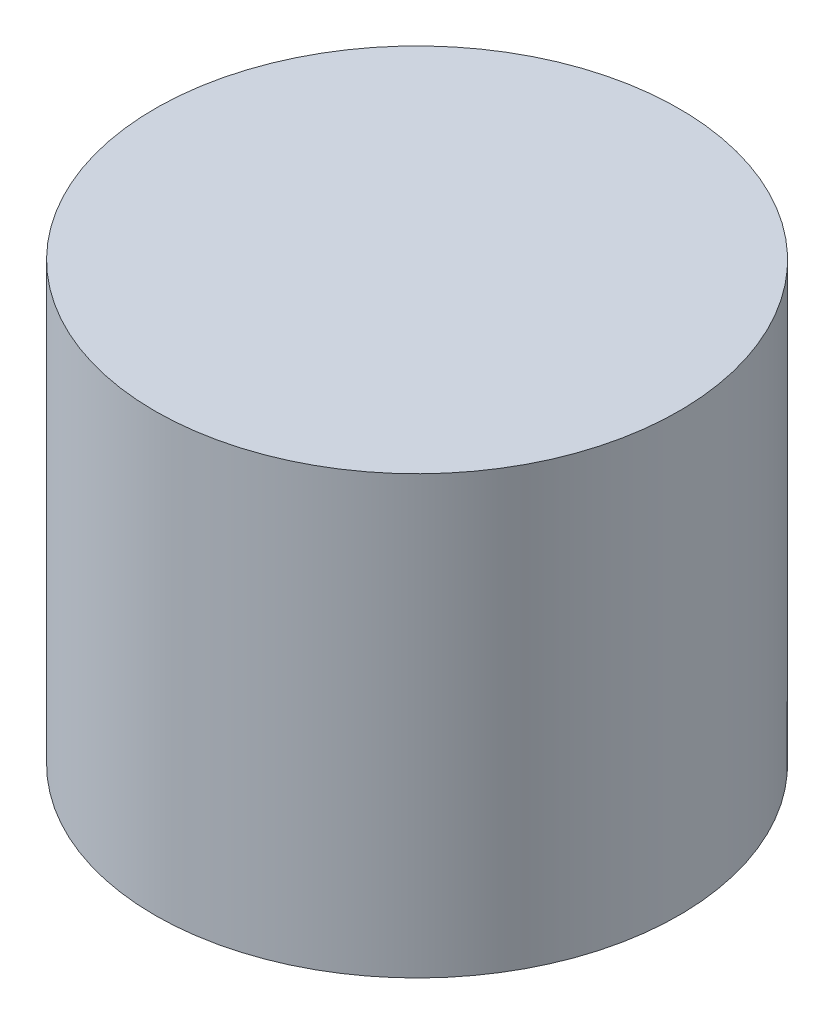
from build123d import *

# Parameters (mm, degrees)
SKETCH1_R           = 90
BOSS_EXTRUDE1_DEPTH = 150


with BuildPart() as part:
    # Sketch1 → Boss-Extrude1 (new body)
    with BuildSketch(Plane(origin=(0, 0, 0), x_dir=(1, 0, 0), z_dir=(0, 1, 0))):
        with Locations(Location((0, 0, 0), (0, 0, 270))):
            Circle(SKETCH1_R)
    extrude(amount=BOSS_EXTRUDE1_DEPTH)


solid = part.part
